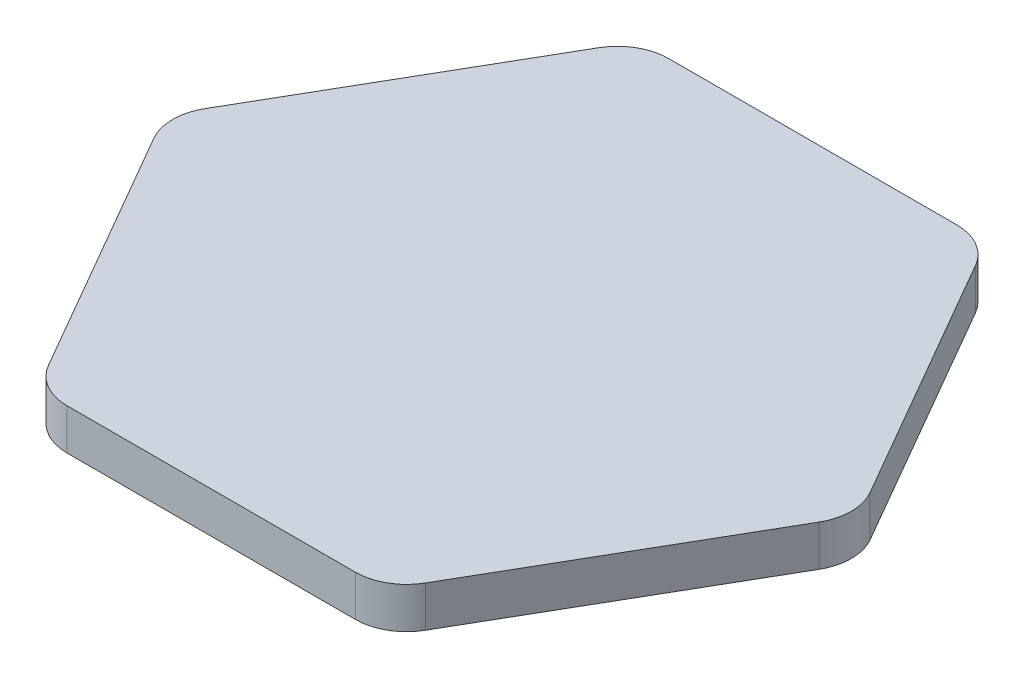
from build123d import *

# Parameters (mm, degrees)
BOSS_EXTRUDE1_DEPTH = 12


with BuildPart() as part:
    # Sketch1 → Boss-Extrude1 (new body)
    with BuildSketch(Plane(origin=(0, 0, 0), x_dir=(1, 0, 0), z_dir=(0, 1, 0))):
        with BuildLine():
            Line((42.204304678, 88.1), (-42.204304678, 88.1))
            ThreePointArc((-42.204304678, 88.1), (-49.704304678, 86.090381057), (-55.194685735, 80.6))
            Line((-55.194685735, 80.6), (-97.398990412, 7.5))
            ThreePointArc((-97.398990412, 7.5), (-99.408609356, 0), (-97.398990412, -7.5))
            Line((-97.398990412, -7.5), (-55.194685735, -80.6))
            ThreePointArc((-55.194685735, -80.6), (-49.704304678, -86.090381057), (-42.204304678, -88.1))
            Line((-42.204304678, -88.1), (42.204304678, -88.1))
            ThreePointArc((42.204304678, -88.1), (49.704304678, -86.090381057), (55.194685735, -80.6))
            Line((55.194685735, -80.6), (97.398990412, -7.5))
            ThreePointArc((97.398990412, -7.5), (99.408609356, 0), (97.398990412, 7.5))
            Line((97.398990412, 7.5), (55.194685735, 80.6))
            ThreePointArc((55.194685735, 80.6), (49.704304678, 86.090381057), (42.204304678, 88.1))
        make_face()
    extrude(amount=-BOSS_EXTRUDE1_DEPTH)


solid = part.part
